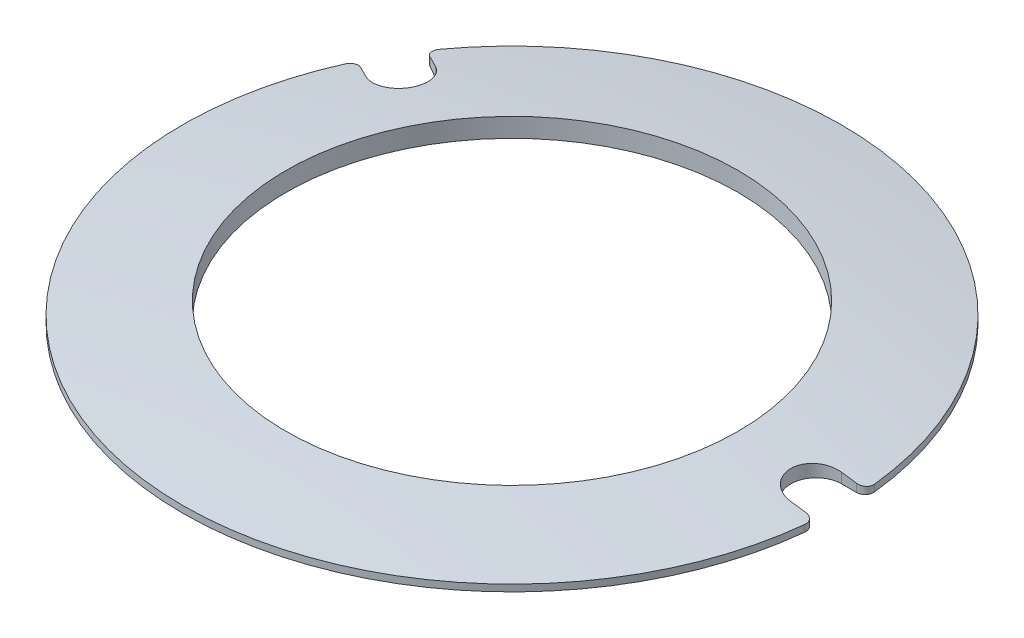
from build123d import *

# Parameters (mm, degrees)
CUT_EXTRUDE2_DEPTH = 283.892205619
FILLET1_R          = 1


with BuildPart() as part:
    # Sketch1 → Revolve1 (revolve)
    with BuildSketch(Plane.XY, mode=Mode.PRIVATE) as revolve1_sk:
        with BuildLine():
            Line((39, 275.208265275), (26.75, 275.208265275))
            Line((26.75, 275.208265275), (26.75, 277.463511115))
            ThreePointArc((26.75, 277.463511115), (32.883051259, 276.803662259), (39, 276.008265275))
            Line((39, 276.008265275), (39, 275.208265275))
        make_face()
    revolve(revolve1_sk.sketch.rotate(Axis((0, 0, 0), (0, 1, 0)), 90), axis=Axis((0, 0, 0), (0, 1, 0)))

    # Sketch2 → Cut-Extrude2 (cut, through all)
    with BuildSketch(Plane(origin=(0, 0, 0), x_dir=(1, 0, 0), z_dir=(0, 1, 0))):
        with BuildLine():
            Line((36, 3), (46, 3))
            ThreePointArc((46, 3), (49, 0), (46, -3))
            Line((46, -3), (36, -3))
            ThreePointArc((36, -3), (33, 0), (36, 3))
        make_face()
        with BuildLine():
            Line((-32.676914536, 15.401923789), (-41.337168574, 20.401923789))
            ThreePointArc((-41.337168574, 20.401923789), (-42.435244785, 24.5), (-38.337168574, 25.598076211))
            Line((-38.337168574, 25.598076211), (-29.676914536, 20.598076211))
            ThreePointArc((-29.676914536, 20.598076211), (-28.578838325, 16.5), (-32.676914536, 15.401923789))
        make_face()
    extrude(amount=CUT_EXTRUDE2_DEPTH, mode=Mode.SUBTRACT)

    # Fillet1
    fillet1_edges = [part.edges().sort_by_distance(p)[0] for p in [
        (38.88444419, 275.608265275, 3),
        (38.88444419, 275.608265275, -3),
        (-32.174916481, 275.608265275, -22.040298307),
        (-35.174916481, 275.608265275, -16.844145884),
    ]]
    fillet(fillet1_edges, radius=FILLET1_R)


solid = part.part
